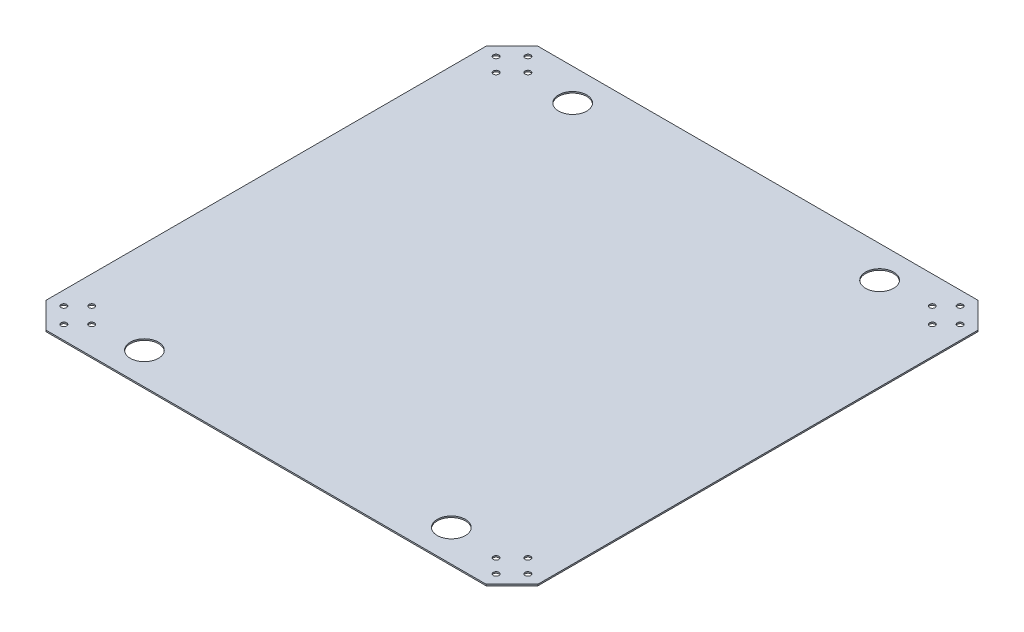
from build123d import *

# Parameters (mm, degrees)
SKETCH2_R           = 2
SKETCH2_R_2         = 10
BOSS_EXTRUDE3_DEPTH = 1


with BuildPart() as part:
    # Sketch2 → Boss-Extrude3 (new body)
    with BuildSketch(Plane(origin=(0, 0, 0), x_dir=(1, 0, 0), z_dir=(0, 1, 0))):
        Polygon((-156.615, 175), (156.615, 175), (175, 156.615), (175, -156.615), (156.615, -175), (-156.615, -175), (-175, -156.615), (-175, 156.615), align=None)
        with Locations(Location((-165.100505063, 153.786572875, 0), (0, 0, 270))):
            Circle(SKETCH2_R, mode=Mode.SUBTRACT)
        with Locations(Location((-153.786572875, 165.100505063, 0), (0, 0, 270))):
            Circle(SKETCH2_R, mode=Mode.SUBTRACT)
        with Locations(Location((-155.201010127, 143.887077939, 0), (0, 0, 270))):
            Circle(SKETCH2_R, mode=Mode.SUBTRACT)
        with Locations(Location((-143.887301628, 155.200786438, 0), (0, 0, 270))):
            Circle(SKETCH2_R, mode=Mode.SUBTRACT)
        with Locations(Location((153.786572875, 165.100505063, 0), (0, 0, 270))):
            Circle(SKETCH2_R, mode=Mode.SUBTRACT)
        with Locations(Location((165.100505063, 153.786572875, 0), (0, 0, 270))):
            Circle(SKETCH2_R, mode=Mode.SUBTRACT)
        with Locations(Location((143.887077939, 155.201010127, 0), (0, 0, 270))):
            Circle(SKETCH2_R, mode=Mode.SUBTRACT)
        with Locations(Location((155.200786438, 143.887301628, 0), (0, 0, 270))):
            Circle(SKETCH2_R, mode=Mode.SUBTRACT)
        with Locations(Location((165.100505063, -153.786572875, 0), (0, 0, 270))):
            Circle(SKETCH2_R, mode=Mode.SUBTRACT)
        with Locations(Location((153.786572875, -165.100505063, 0), (0, 0, 270))):
            Circle(SKETCH2_R, mode=Mode.SUBTRACT)
        with Locations(Location((155.201010127, -143.887077939, 0), (0, 0, 270))):
            Circle(SKETCH2_R, mode=Mode.SUBTRACT)
        with Locations(Location((143.887301628, -155.200786438, 0), (0, 0, 270))):
            Circle(SKETCH2_R, mode=Mode.SUBTRACT)
        with Locations(Location((-153.786572875, -165.100505063, 0), (0, 0, 270))):
            Circle(SKETCH2_R, mode=Mode.SUBTRACT)
        with Locations(Location((-165.100505063, -153.786572875, 0), (0, 0, 270))):
            Circle(SKETCH2_R, mode=Mode.SUBTRACT)
        with Locations(Location((-143.887077939, -155.201010127, 0), (0, 0, 270))):
            Circle(SKETCH2_R, mode=Mode.SUBTRACT)
        with Locations(Location((-155.200786438, -143.887301628, 0), (0, 0, 270))):
            Circle(SKETCH2_R, mode=Mode.SUBTRACT)
        with Locations(Location((-109.204108061, 152.372583002, 0), (0, 0, 270))):
            Circle(SKETCH2_R_2, mode=Mode.SUBTRACT)
        with Locations(Location((109.204108061, 152.372583002, 0), (0, 0, 270))):
            Circle(SKETCH2_R_2, mode=Mode.SUBTRACT)
        with Locations(Location((109.204108061, -152.372583002, 0), (0, 0, 270))):
            Circle(SKETCH2_R_2, mode=Mode.SUBTRACT)
        with Locations(Location((-109.204108061, -152.372583002, 0), (0, 0, 270))):
            Circle(SKETCH2_R_2, mode=Mode.SUBTRACT)
    extrude(amount=BOSS_EXTRUDE3_DEPTH)


solid = part.part
